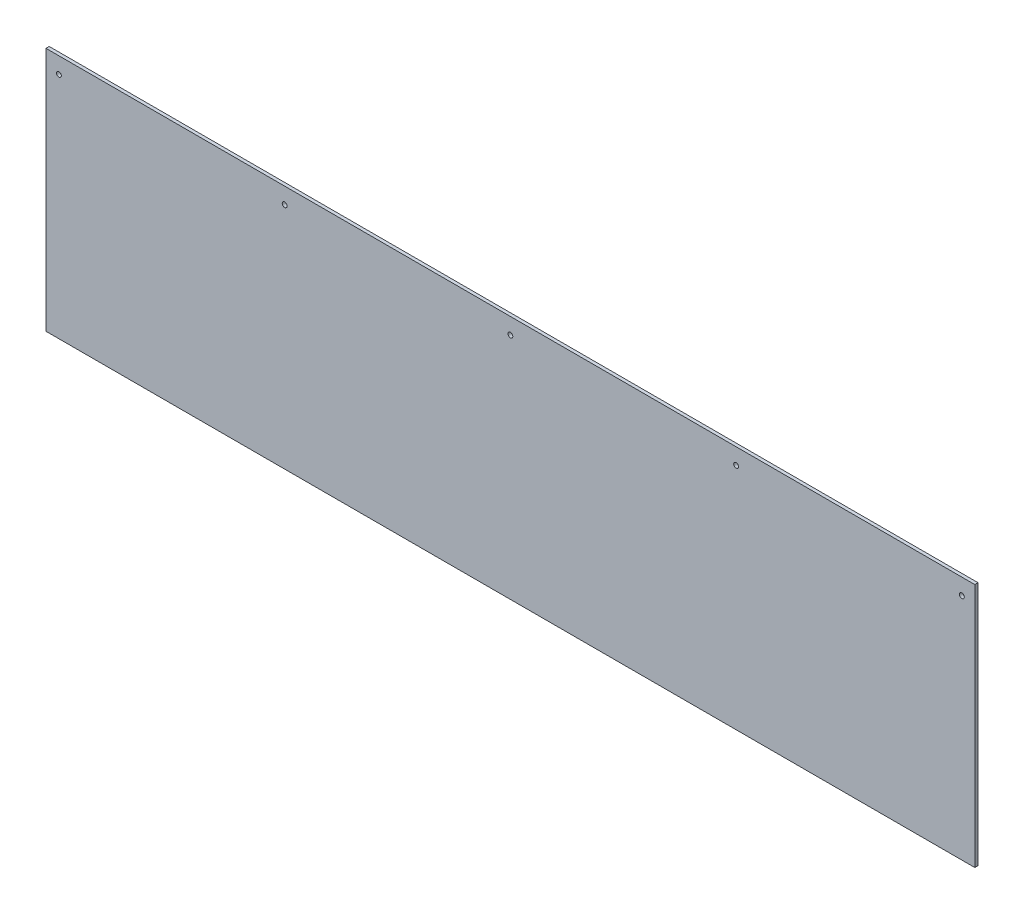
from build123d import *

# Parameters (mm, degrees)
SKETCH1_W           = 1828.8
SKETCH1_H           = 482.6
BOSS_EXTRUDE1_DEPTH = 6.35
SKETCH2_R           = 4.7625
CUT_EXTRUDE1_DEPTH  = 1892.415481194


with BuildPart() as part:
    # Sketch1 → Boss-Extrude1 (new body)
    with BuildSketch(Plane.XY):
        with Locations((914.4, 241.3)):
            Rectangle(SKETCH1_W, SKETCH1_H)
    extrude(amount=BOSS_EXTRUDE1_DEPTH)

    # Sketch2 → Cut-Extrude1 (cut, through all)
    with BuildSketch(Plane.XY.offset(6.35)):
        with Locations((25.4, 450.85)):
            Circle(SKETCH2_R)
        with Locations((469.9, 450.85)):
            Circle(SKETCH2_R)
        with Locations((914.4, 450.85)):
            Circle(SKETCH2_R)
        with Locations((1358.9, 450.85)):
            Circle(SKETCH2_R)
        with Locations((1803.4, 450.85)):
            Circle(SKETCH2_R)
    extrude(amount=-CUT_EXTRUDE1_DEPTH, mode=Mode.SUBTRACT)


solid = part.part
